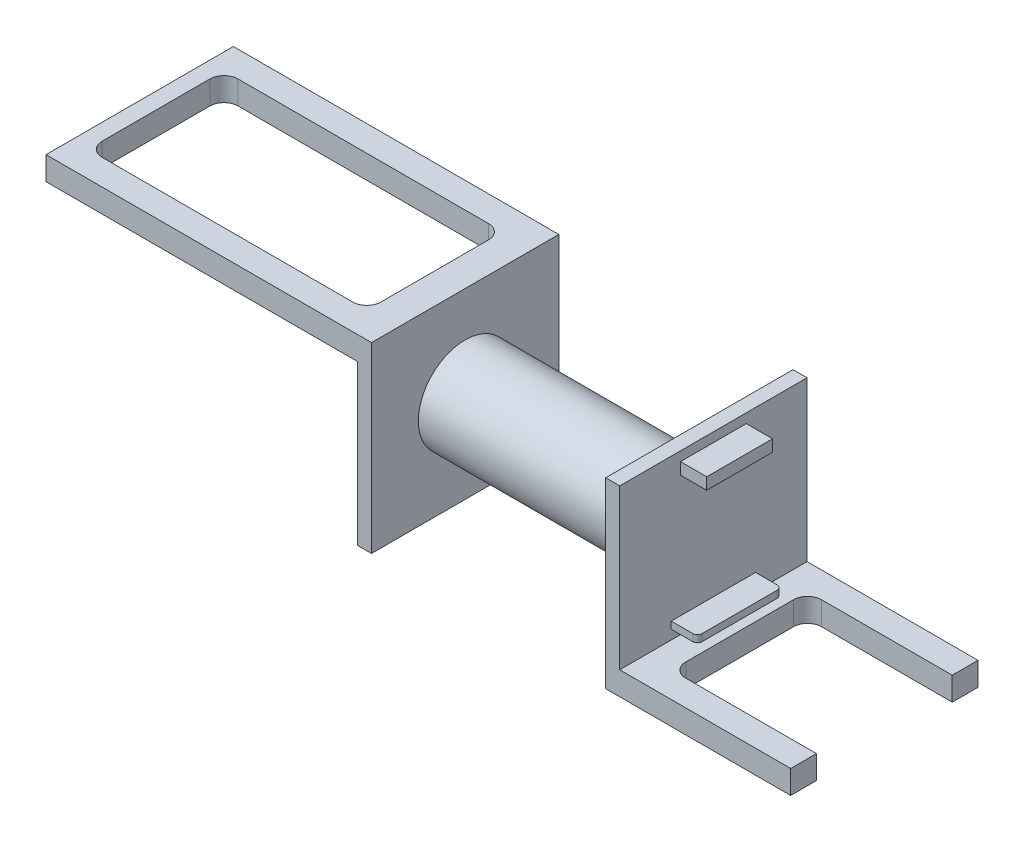
from build123d import *

# Parameters (mm, degrees)
SKETCH2_W           = 66.5
SKETCH2_H           = 40
BOSS_EXTRUDE1_DEPTH = 5
SKETCH5_W           = 40
SKETCH5_H           = 39
BOSS_EXTRUDE3_DEPTH = 3
SKETCH11_W          = 14.05
SKETCH11_H          = 2.5
SKETCH11_W_2        = 18
SKETCH11_H_2        = 1.5
BOSS_EXTRUDE4_DEPTH = 5.6
FILLET4_R           = 1
FILLET6_R           = 10
SKETCH12_W          = 30
SKETCH12_H          = 40
CUT_EXTRUDE1_DEPTH  = 10
SKETCH13_R          = 10
BOSS_EXTRUDE5_DEPTH = 50
SKETCH14_W          = 40
SKETCH14_H          = 39
BOSS_EXTRUDE6_DEPTH = 3
SKETCH15_W          = 40
SKETCH15_H          = 5
BOSS_EXTRUDE7_DEPTH = 66.5
CUT_EXTRUDE2_DEPTH  = 5


with BuildPart() as part:
    # Sketch2 → Boss-Extrude1 (new body)
    with BuildSketch(Plane(origin=(0, 0, 0), x_dir=(1, 0, 0), z_dir=(0, 1, 0))):
        Rectangle(SKETCH2_W, SKETCH2_H)
        with BuildLine():
            Line((-27.65, 11.5), (-27.65, -11.5))
            ThreePointArc((-27.65, -11.5), (-26.771320344, -13.621320344), (-24.65, -14.5))
            Line((-24.65, -14.5), (28.85, -14.5))
            ThreePointArc((28.85, -14.5), (30.971320344, -13.621320344), (31.85, -11.5))
            Line((31.85, -11.5), (31.85, 11.5))
            ThreePointArc((31.85, 11.5), (30.971320344, 13.621320344), (28.85, 14.5))
            Line((28.85, 14.5), (-24.65, 14.5))
            ThreePointArc((-24.65, 14.5), (-26.771320344, 13.621320344), (-27.65, 11.5))
        make_face(mode=Mode.SUBTRACT)
    extrude(amount=BOSS_EXTRUDE1_DEPTH)

    # Sketch5 → Boss-Extrude3 (add)
    with BuildSketch(Plane.ZY.offset(33.25)):
        with Locations((0, 19.5)):
            Rectangle(SKETCH5_W, SKETCH5_H)
    extrude(amount=BOSS_EXTRUDE3_DEPTH)

    # Sketch11 → Boss-Extrude4 (add)
    with BuildSketch(Plane(origin=(-33.25, 0, 0), x_dir=(0, 0, -1), z_dir=(1, 0, 0))):
        with Locations((0, 35.75)):
            Rectangle(SKETCH11_W, SKETCH11_H)
        with Locations((0, 7.75)):
            Rectangle(SKETCH11_W_2, SKETCH11_H_2)
    extrude(amount=BOSS_EXTRUDE4_DEPTH)

    # Fillet4
    fillet4_edges = [part.edges().sort_by_distance(p)[0] for p in [
        (-27.65, 7.75, -9),
        (-27.65, 7.75, 9),
    ]]
    fillet(fillet4_edges, radius=FILLET4_R)

    # Fillet6
    fillet6_edges = [part.edges().sort_by_distance(p)[0] for p in [
        (33.25, 2.5, 20),
        (33.25, 2.5, -20),
    ]]
    fillet(fillet6_edges, radius=FILLET6_R)

    # Sketch12 → Cut-Extrude1 (cut)
    with BuildSketch(Plane.XZ):
        with Locations((18.25, 0)):
            Rectangle(SKETCH12_W, SKETCH12_H)
    extrude(amount=-CUT_EXTRUDE1_DEPTH, mode=Mode.SUBTRACT)

    # Sketch13 → Boss-Extrude5 (add)
    with BuildSketch(Plane.ZY.offset(36.25)):
        with Locations((0, 19.5)):
            Circle(SKETCH13_R)
    extrude(amount=BOSS_EXTRUDE5_DEPTH)

    # Sketch14 → Boss-Extrude6 (add)
    with BuildSketch(Plane.ZY.offset(86.25)):
        with Locations((0, 19.5)):
            Rectangle(SKETCH14_W, SKETCH14_H)
    extrude(amount=BOSS_EXTRUDE6_DEPTH)

    # Sketch15 → Boss-Extrude7 (add)
    with BuildSketch(Plane.ZY.offset(89.25)):
        with Locations((0, 36.5)):
            Rectangle(SKETCH15_W, SKETCH15_H)
    extrude(amount=BOSS_EXTRUDE7_DEPTH)

    # Sketch16 → Cut-Extrude2 (cut)
    with BuildSketch(Plane.XZ.offset(-34)):
        with BuildLine():
            Line((-152.25, 11.5), (-152.25, -11.5))
            ThreePointArc((-152.25, -11.5), (-151.371320344, -13.621320344), (-149.25, -14.5))
            Line((-149.25, -14.5), (-95.75, -14.5))
            ThreePointArc((-95.75, -14.5), (-93.628679656, -13.621320344), (-92.75, -11.5))
            Line((-92.75, -11.5), (-92.75, 11.5))
            ThreePointArc((-92.75, 11.5), (-93.628679656, 13.621320344), (-95.75, 14.5))
            Line((-95.75, 14.5), (-149.25, 14.5))
            ThreePointArc((-149.25, 14.5), (-151.371320344, 13.621320344), (-152.25, 11.5))
        make_face()
    extrude(amount=-CUT_EXTRUDE2_DEPTH, mode=Mode.SUBTRACT)


solid = part.part
